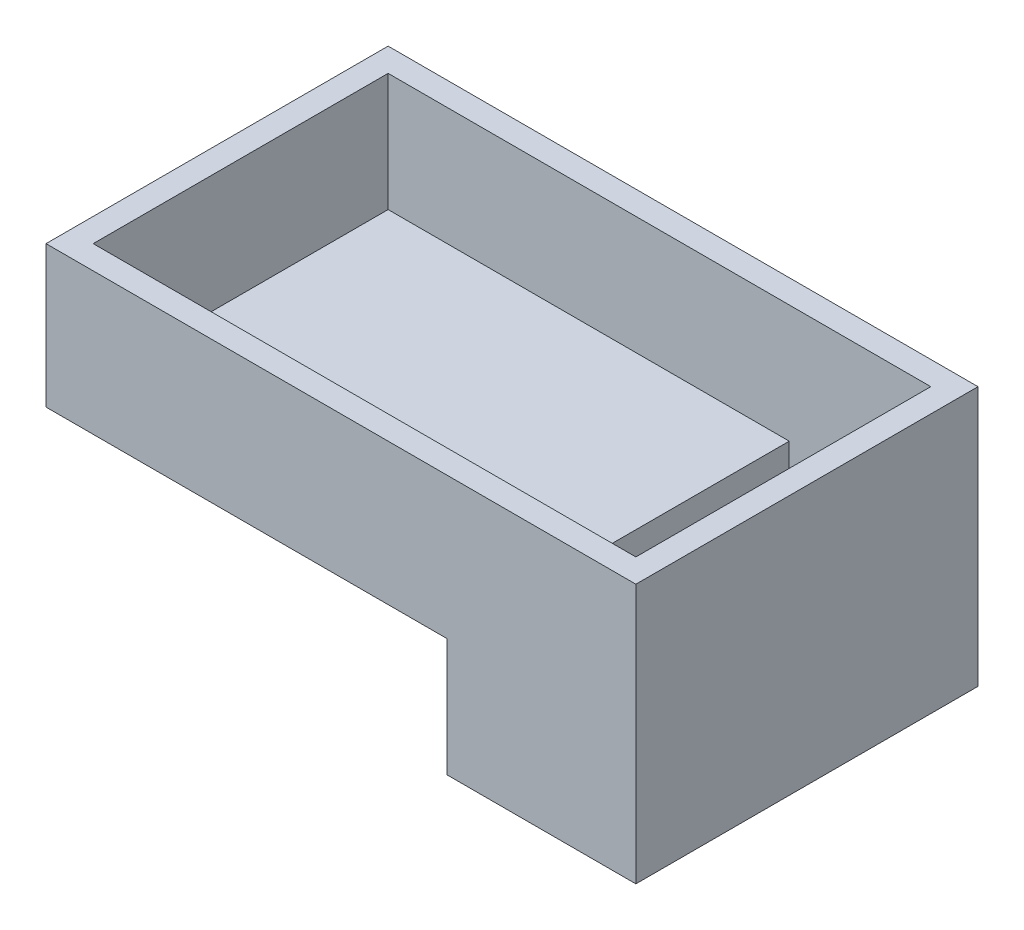
from build123d import *

# Parameters (mm, degrees)
EXTRUDE_1_DEPTH = 1
EXTRUDE_2_DEPTH = 12.5
EXTRUDE_4_DEPTH = 1


with BuildPart() as part:
    # 草图1 → 凸台-拉伸1 (new body)
    with BuildSketch(Plane.XY):
        Polygon((-53.921953221, 26.960976611), (-53.921953221, 20.960976611), (-36.921953221, 20.960976611), (-36.921953221, 15.960976611), (-28.921953221, 15.960976611), (-28.921953221, 26.960976611), align=None)
    extrude(amount=EXTRUDE_1_DEPTH)

    # 草图2 → 凸台-拉伸2 (add)
    with BuildSketch(Plane.XY.offset(1)):
        Polygon((-53.921953221, 26.960976611), (-52.921953221, 26.960976611), (-52.921953221, 21.960976611), (-35.921953221, 21.960976611), (-35.921953221, 16.960976611), (-29.921953221, 16.960976611), (-29.921953221, 26.960976611), (-28.921953221, 26.960976611), (-28.921953221, 15.960976611), (-36.921953221, 15.960976611), (-36.921953221, 20.960976611), (-53.921953221, 20.960976611), align=None)
    extrude(amount=EXTRUDE_2_DEPTH)

    # 草图4 → 凸台-拉伸4 (add)
    with BuildSketch(Plane.XY.offset(13.5)):
        Polygon((-53.921953221, 26.960976611), (-28.921953221, 26.960976611), (-28.921953221, 15.960976611), (-36.921953221, 15.960976611), (-36.921953221, 20.960976611), (-53.921953221, 20.960976611), align=None)
    extrude(amount=EXTRUDE_4_DEPTH)


solid = part.part
